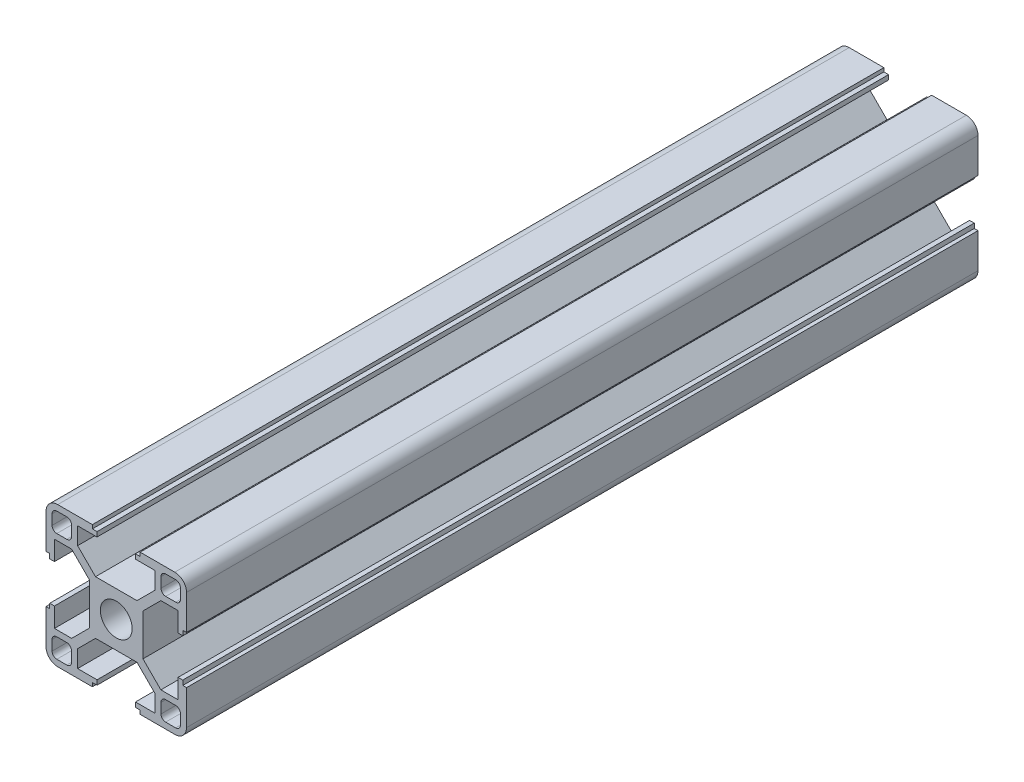
from build123d import *

# Parameters (mm, degrees)
SKETCH1_R      = 3.4
EXTRUDE1_DEPTH = 169
EXTRUDE2_DEPTH = 171.326157709


with BuildPart() as part:
    # Sketch1 → Extrude1 (new body)
    with BuildSketch(Plane.XY):
        with BuildLine():
            Line((-5.1, 14.2), (-5.1, 15))
            Line((-5.1, 15), (-12.5, 15))
            ThreePointArc((-12.5, 15), (-14.267766953, 14.267766953), (-15, 12.5))
            Line((-15, 12.5), (-15, 5.1))
            Line((-15, 5.1), (-14.2, 5.1))
            Line((-14.2, 5.1), (-14.2, 4.1))
            Line((-14.2, 4.1), (-13.2, 4.1))
            Line((-13.2, 4.1), (-13.2, 8.25))
            Line((-13.2, 8.25), (-9.522792206, 8.25))
            Line((-9.522792206, 8.25), (-5.7, 4.427207794))
            Line((-5.7, 4.427207794), (-5.7, -4.427207794))
            Line((-5.7, -4.427207794), (-9.522792206, -8.25))
            Line((-9.522792206, -8.25), (-13.2, -8.25))
            Line((-13.2, -8.25), (-13.2, -4.1))
            Line((-13.2, -4.1), (-14.2, -4.1))
            Line((-14.2, -4.1), (-14.2, -5.1))
            Line((-14.2, -5.1), (-15, -5.1))
            Line((-15, -5.1), (-15, -12.5))
            ThreePointArc((-15, -12.5), (-14.267766953, -14.267766953), (-12.5, -15))
            Line((-12.5, -15), (-5.1, -15))
            Line((-5.1, -15), (-5.1, -14.2))
            Line((-5.1, -14.2), (-4.1, -14.2))
            Line((-4.1, -14.2), (-4.1, -13.2))
            Line((-4.1, -13.2), (-8.25, -13.2))
            Line((-8.25, -13.2), (-8.25, -9.522792206))
            Line((-8.25, -9.522792206), (-4.427207794, -5.7))
            Line((-4.427207794, -5.7), (4.427207794, -5.7))
            Line((4.427207794, -5.7), (8.25, -9.522792206))
            Line((8.25, -9.522792206), (8.25, -13.2))
            Line((8.25, -13.2), (4.1, -13.2))
            Line((4.1, -13.2), (4.1, -14.2))
            Line((4.1, -14.2), (5.1, -14.2))
            Line((5.1, -14.2), (5.1, -15))
            Line((5.1, -15), (12.5, -15))
            ThreePointArc((12.5, -15), (14.267766953, -14.267766953), (15, -12.5))
            Line((15, -12.5), (15, -5.1))
            Line((15, -5.1), (14.2, -5.1))
            Line((14.2, -5.1), (14.2, -4.1))
            Line((14.2, -4.1), (13.2, -4.1))
            Line((13.2, -4.1), (13.2, -8.25))
            Line((13.2, -8.25), (9.522792206, -8.25))
            Line((9.522792206, -8.25), (5.7, -4.427207794))
            Line((5.7, -4.427207794), (5.7, 4.427207794))
            Line((5.7, 4.427207794), (9.522792206, 8.25))
            Line((9.522792206, 8.25), (13.2, 8.25))
            Line((13.2, 8.25), (13.2, 4.1))
            Line((13.2, 4.1), (14.2, 4.1))
            Line((14.2, 4.1), (14.2, 5.1))
            Line((14.2, 5.1), (15, 5.1))
            Line((15, 5.1), (15, 12.5))
            ThreePointArc((15, 12.5), (14.267766953, 14.267766953), (12.5, 15))
            Line((12.5, 15), (5.1, 15))
            Line((5.1, 15), (5.1, 14.2))
            Line((5.1, 14.2), (4.1, 14.2))
            Line((4.1, 14.2), (4.1, 13.2))
            Line((4.1, 13.2), (8.25, 13.2))
            Line((8.25, 13.2), (8.25, 9.522792206))
            Line((8.25, 9.522792206), (4.427207794, 5.7))
            Line((4.427207794, 5.7), (-4.427207794, 5.7))
            Line((-4.427207794, 5.7), (-8.25, 9.522792206))
            Line((-8.25, 9.522792206), (-8.25, 13.2))
            Line((-8.25, 13.2), (-4.1, 13.2))
            Line((-4.1, 13.2), (-4.1, 14.2))
            Line((-4.1, 14.2), (-5.1, 14.2))
        make_face()
        Circle(SKETCH1_R, mode=Mode.SUBTRACT)
    extrude(amount=EXTRUDE1_DEPTH)

    # Sketch2 → Extrude2 (cut, through all)
    with BuildSketch(Plane.XY.offset(169)):
        with BuildLine():
            Line((13.7, 12.7), (13.7, 10.55))
            ThreePointArc((13.7, 10.55), (13.407106781, 9.842893219), (12.7, 9.55))
            Line((12.7, 9.55), (10.55, 9.55))
            ThreePointArc((10.55, 9.55), (9.842893219, 9.842893219), (9.55, 10.55))
            Line((9.55, 10.55), (9.55, 12.7))
            ThreePointArc((9.55, 12.7), (9.842893219, 13.407106781), (10.55, 13.7))
            Line((10.55, 13.7), (12.7, 13.7))
            ThreePointArc((12.7, 13.7), (13.407106781, 13.407106781), (13.7, 12.7))
        make_face()
        with BuildLine():
            Line((-12.7, 13.7), (-10.55, 13.7))
            ThreePointArc((-10.55, 13.7), (-9.842893219, 13.407106781), (-9.55, 12.7))
            Line((-9.55, 12.7), (-9.55, 10.55))
            ThreePointArc((-9.55, 10.55), (-9.842893219, 9.842893219), (-10.55, 9.55))
            Line((-10.55, 9.55), (-12.7, 9.55))
            ThreePointArc((-12.7, 9.55), (-13.407106781, 9.842893219), (-13.7, 10.55))
            Line((-13.7, 10.55), (-13.7, 12.7))
            ThreePointArc((-13.7, 12.7), (-13.407106781, 13.407106781), (-12.7, 13.7))
        make_face()
        with BuildLine():
            Line((12.7, -13.7), (10.55, -13.7))
            ThreePointArc((10.55, -13.7), (9.842893219, -13.407106781), (9.55, -12.7))
            Line((9.55, -12.7), (9.55, -10.55))
            ThreePointArc((9.55, -10.55), (9.842893219, -9.842893219), (10.55, -9.55))
            Line((10.55, -9.55), (12.7, -9.55))
            ThreePointArc((12.7, -9.55), (13.407106781, -9.842893219), (13.7, -10.55))
            Line((13.7, -10.55), (13.7, -12.7))
            ThreePointArc((13.7, -12.7), (13.407106781, -13.407106781), (12.7, -13.7))
        make_face()
        with BuildLine():
            Line((-13.7, -12.7), (-13.7, -10.55))
            ThreePointArc((-13.7, -10.55), (-13.407106781, -9.842893219), (-12.7, -9.55))
            Line((-12.7, -9.55), (-10.55, -9.55))
            ThreePointArc((-10.55, -9.55), (-9.842893219, -9.842893219), (-9.55, -10.55))
            Line((-9.55, -10.55), (-9.55, -12.7))
            ThreePointArc((-9.55, -12.7), (-9.842893219, -13.407106781), (-10.55, -13.7))
            Line((-10.55, -13.7), (-12.7, -13.7))
            ThreePointArc((-12.7, -13.7), (-13.407106781, -13.407106781), (-13.7, -12.7))
        make_face()
    extrude(amount=-EXTRUDE2_DEPTH, mode=Mode.SUBTRACT)


solid = part.part
